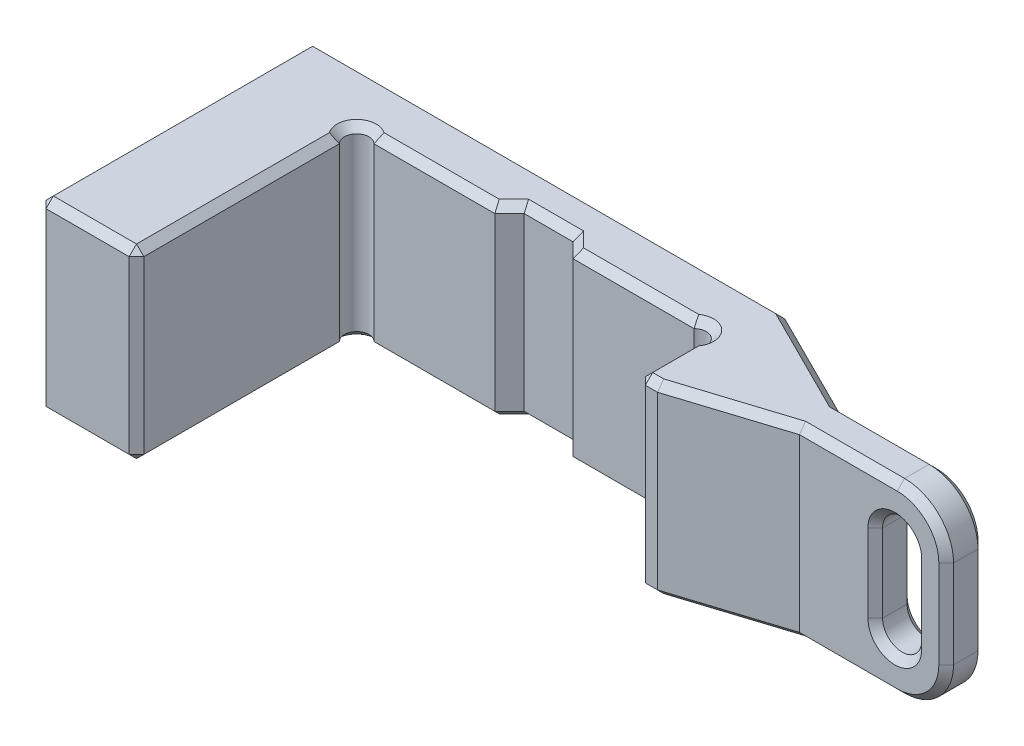
from build123d import *

# Parameters (mm, degrees)
CREATE_PROFILE_DEPTH     = 38
CUT_SHACKLE_HOLE_DEPTH   = 160.753716702
ROUND_EDGES_R            = 10
UNECESSARY_CHAMFERS_SIZE = 1.5


with BuildPart() as part:
    # Sketch1 → Create profile (new body)
    with BuildSketch(Plane(origin=(0, 0, 0), x_dir=(1, 0, 0), z_dir=(0, 1, 0))):
        with BuildLine():
            Line((0, 0), (0, 56))
            Line((0, 56), (96.5, 56))
            Line((96.5, 56), (118.5, 45))
            Line((118.5, 45), (148.5, 45))
            Line((148.5, 45), (148.5, 37))
            Line((148.5, 37), (118.5, 37))
            Line((118.5, 37), (96.5, 30))
            Line((96.5, 30), (92.5, 30))
            Line((92.5, 30), (92.5, 41.464466094))
            ThreePointArc((92.5, 41.464466094), (92.5, 45), (88.964466094, 45))
            Line((88.964466094, 45), (64.25, 45))
            Line((64.25, 45), (61.25, 48))
            Line((61.25, 48), (51.25, 48))
            Line((51.25, 48), (48.25, 45))
            Line((48.25, 45), (23.535533906, 45))
            ThreePointArc((23.535533906, 45), (20, 45), (20, 41.464466094))
            Line((20, 41.464466094), (20, 0))
            Line((20, 0), (0, 0))
        make_face()
    extrude(amount=CREATE_PROFILE_DEPTH)

    # Sketch3 → Cut shackle hole (cut, through all)
    with BuildSketch(Plane(origin=(0, 0, -45), x_dir=(-1, 0, 0), z_dir=(0, 0, -1))):
        with BuildLine():
            Line((-134, 27), (-134, 11))
            ThreePointArc((-134, 11), (-138, 7), (-142, 11))
            Line((-142, 11), (-142, 27))
            ThreePointArc((-142, 27), (-138, 31), (-134, 27))
        make_face()
    extrude(amount=-CUT_SHACKLE_HOLE_DEPTH, mode=Mode.SUBTRACT)

    # Round Edges
    round_edges_edges = [part.edges().sort_by_distance(p)[0] for p in [
        (148.5, 0, -41),
        (148.5, 38, -41),
    ]]
    fillet(round_edges_edges, radius=ROUND_EDGES_R)

    # Unecessary chamfers
    unecessary_chamfers_edges = [part.edges().sort_by_distance(p)[0] for p in [
        (20, 38, -45),
        (35.892766953, 38, -45),
        (0, 0, -28),
        (48.25, 0, -56),
        (107.5, 0, -50.5),
        (128.5, 0, -37),
        (107.5, 0, -33.5),
        (94.5, 0, -30),
        (92.5, 0, -35.732233047),
        (49.75, 38, -46.5),
        (92.5, 0, -45),
        (76.607233047, 0, -45),
        (62.75, 0, -46.5),
        (56.25, 0, -48),
        (49.75, 0, -46.5),
        (35.892766953, 0, -45),
        (20, 0, -45),
        (20, 0, -20.732233047),
        (10, 0, 0),
        (56.25, 38, -48),
        (62.75, 38, -46.5),
        (0, 19, 0),
        (0, 19, -56),
        (92.5, 19, -30),
        (20, 19, 0),
        (76.607233047, 38, -45),
        (92.5, 38, -45),
        (92.5, 38, -35.732233047),
        (94.5, 38, -30),
        (107.5, 38, -33.5),
        (10, 38, 0),
        (128.5, 38, -37),
        (138, 31, -37),
        (134, 19, -37),
        (138, 7, -37),
        (142, 19, -37),
        (138, 31, -45),
        (142, 19, -45),
        (138, 7, -45),
        (134, 19, -45),
        (107.5, 38, -50.5),
        (48.25, 38, -56),
        (0, 38, -28),
        (148.5, 19, -45),
        (148.5, 19, -37),
        (128.5, 0, -45),
        (128.5, 38, -45),
        (145.571067812, 35.071067812, -45),
        (145.571067812, 2.928932188, -45),
        (145.571067812, 35.071067812, -37),
        (145.571067812, 2.928932188, -37),
        (20, 38, -20.732233047),
    ]]
    chamfer(unecessary_chamfers_edges, length=UNECESSARY_CHAMFERS_SIZE)


solid = part.part
